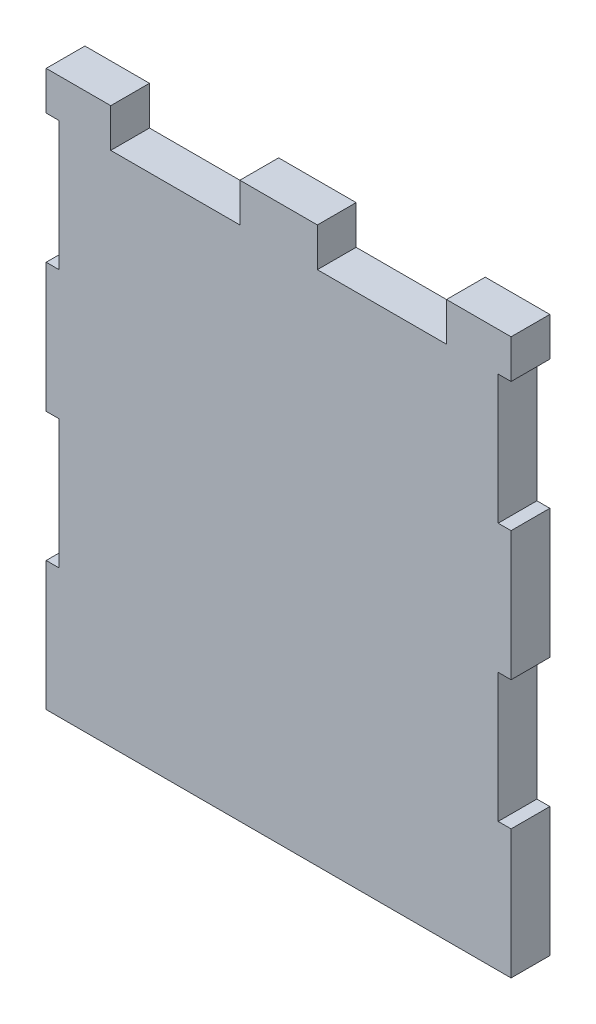
from build123d import *

# Parameters (mm, degrees)
SKETCH1_W           = 1
SKETCH1_H           = 10
BOSS_EXTRUDE1_DEPTH = 3


with BuildPart() as part:
    # Sketch1 → Boss-Extrude1 (new body)
    with BuildSketch(Plane.XY):
        Polygon((1, 10), (1, 0), (18, 0), (18, 40), (15, 40), (5, 40), (1, 40), (1, 30), (1, 20), align=None)
        Polygon((18, 40), (18, 0), (35, 0), (35, 10), (35, 20), (35, 30), (35, 40), (31, 40), (21, 40), align=None)
        with Locations((0.5, 5)):
            Rectangle(SKETCH1_W, SKETCH1_H)
        with Locations((0.5, 25)):
            Rectangle(SKETCH1_W, SKETCH1_H)
        with Locations((35.5, 25)):
            Rectangle(SKETCH1_W, SKETCH1_H)
        with Locations((35.5, 5)):
            Rectangle(SKETCH1_W, SKETCH1_H)
        Polygon((0, 43), (0, 40), (1, 40), (5, 40), (5, 43), align=None)
        Polygon((15, 40), (18, 40), (21, 40), (21, 43), (15, 43), align=None)
        Polygon((31, 43), (31, 40), (35, 40), (36, 40), (36, 43), align=None)
    extrude(amount=BOSS_EXTRUDE1_DEPTH)


solid = part.part
